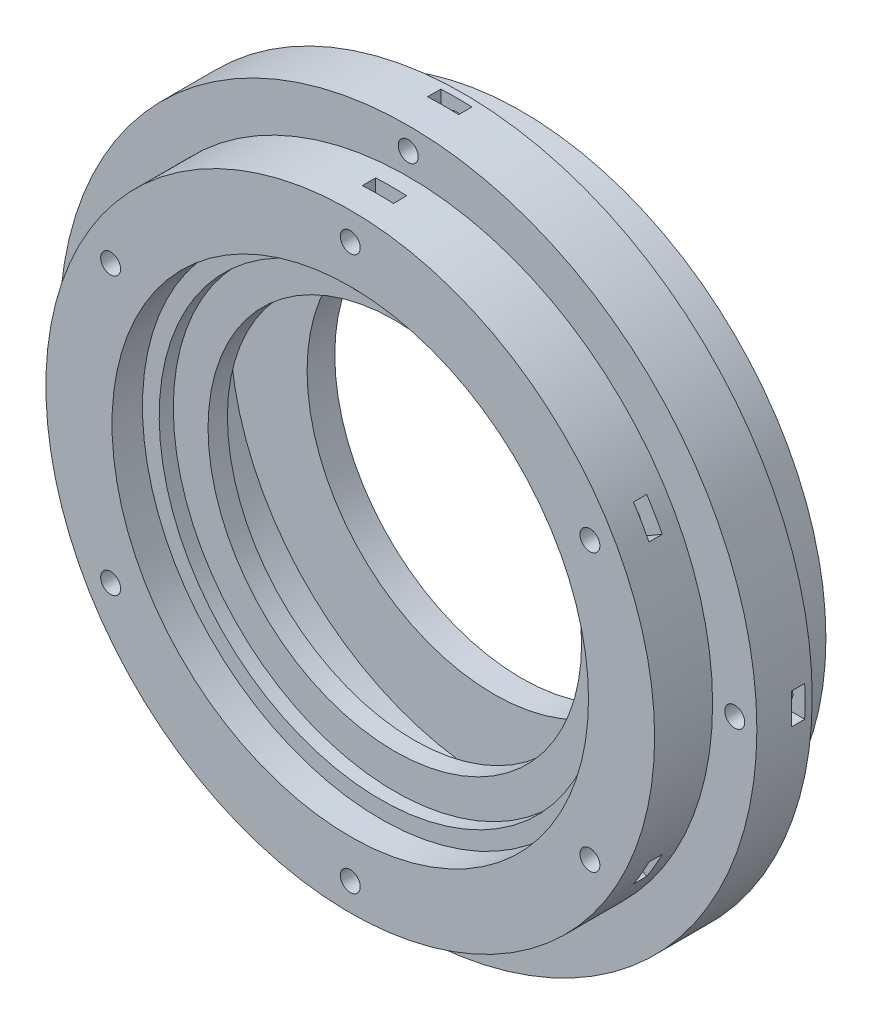
from build123d import *

# Parameters (mm, degrees)
SKETCH2_R           = 1.8
CUT_EXTRUDE1_DEPTH  = 10
SKETCH3_W           = 5.6
SKETCH3_H           = 10.691433847
CUT_EXTRUDE2_DEPTH  = 2.4
BOSS_EXTRUDE1_DEPTH = 2.5
SKETCH5_R           = 1.8
CUT_EXTRUDE3_DEPTH  = 92.417862724
SKETCH6_W           = 5.6
SKETCH6_H           = 10.168713577
SKETCH6_W_2         = 10.168713577
SKETCH6_H_2         = 5.6
CUT_EXTRUDE4_DEPTH  = 2.4


with BuildPart() as part:
    # Sketch1 → Revolve1 (revolve)
    with BuildSketch(Plane(origin=(0, 0, 0), x_dir=(1, 0, 0), z_dir=(0, 1, 0))):
        Polygon((43.05, 0), (43.05, 5.5), (40.025, 5.5), (40.025, 8.05), (33.75, 8.05), (33.75, 11.55), (47.68, 11.55), (47.68, 25.95), (33.75, 25.95), (33.75, 30.95), (44.2, 30.95), (44.2, 28.95), (50.35, 28.95), (50.35, 23.95), (53.5, 23.95), (53.5, 30.95), (55, 30.95), (55, 20.475), (63, 20.475), (63, 10.475), (55, 10.475), (55, 0), align=None)
    revolve(axis=Axis((0, 0, 39.851832449), (0, 0, -1)))

    # Sketch2 → Cut-Extrude1 (cut)
    with BuildSketch(Plane.XY):
        with Locations((0, 50)):
            Circle(SKETCH2_R)
        with Locations((43.301270189, 25)):
            Circle(SKETCH2_R)
        with Locations((43.301270189, -25)):
            Circle(SKETCH2_R)
        with Locations((0, -50)):
            Circle(SKETCH2_R)
        with Locations((-43.301270189, -25)):
            Circle(SKETCH2_R)
        with Locations((-43.301270189, 25)):
            Circle(SKETCH2_R)
    extrude(amount=-CUT_EXTRUDE1_DEPTH, mode=Mode.SUBTRACT)

    # Sketch3 → Cut-Extrude2 (cut)
    with BuildSketch(Plane.XY.offset(-5)):
        with Locations((0, 52.545716924)):
            Rectangle(SKETCH3_W, SKETCH3_H)
        Polygon((51.535452373, 26.520845793), (48.735452373, 31.370588054), (39.476399059, 26.024871131), (42.276399059, 21.175128869), align=None)
        Polygon((48.735452373, -31.370588054), (51.535452373, -26.520845793), (42.276399059, -21.175128869), (39.476399059, -26.024871131), align=None)
        with Locations((0, -52.545716924)):
            Rectangle(SKETCH3_W, SKETCH3_H)
        Polygon((-51.535452373, -26.520845793), (-48.735452373, -31.370588054), (-39.476399059, -26.024871131), (-42.276399059, -21.175128869), align=None)
        Polygon((-48.735452373, 31.370588054), (-51.535452373, 26.520845793), (-42.276399059, 21.175128869), (-39.476399059, 26.024871131), align=None)
    extrude(amount=-CUT_EXTRUDE2_DEPTH, mode=Mode.SUBTRACT)

    # Sketch4 → Boss-Extrude1 (add)
    with BuildSketch(Plane.XY.offset(-5.5)):
        with BuildLine():
            Line((-2.45, 42.980228012), (-2.45, 39.949945244))
            ThreePointArc((-2.45, 39.949945244), (0, 40.025), (2.45, 39.949945244))
            Line((2.45, 39.949945244), (2.45, 42.980228012))
            ThreePointArc((2.45, 42.980228012), (0, 43.05), (-2.45, 42.980228012))
        make_face()
    extrude(amount=BOSS_EXTRUDE1_DEPTH)

    # Sketch5 → Cut-Extrude3 (cut, through all)
    with BuildSketch(Plane.XY.offset(-10.475)):
        with Locations((0, 59)):
            Circle(SKETCH5_R)
        with Locations((59, 0)):
            Circle(SKETCH5_R)
        with Locations((0, -59)):
            Circle(SKETCH5_R)
        with Locations((-59, 0)):
            Circle(SKETCH5_R)
    extrude(amount=-CUT_EXTRUDE3_DEPTH, mode=Mode.SUBTRACT)

    # Sketch6 → Cut-Extrude4 (cut)
    with BuildSketch(Plane.XY.offset(-16.775)):
        with Locations((0, 61.284356789)):
            Rectangle(SKETCH6_W, SKETCH6_H)
        with Locations((61.284356789, 0)):
            Rectangle(SKETCH6_W_2, SKETCH6_H_2)
        with Locations((0, -61.284356789)):
            Rectangle(SKETCH6_W, SKETCH6_H)
        with Locations((-61.284356789, 0)):
            Rectangle(SKETCH6_W_2, SKETCH6_H_2)
    extrude(amount=-CUT_EXTRUDE4_DEPTH, mode=Mode.SUBTRACT)


solid = part.part
